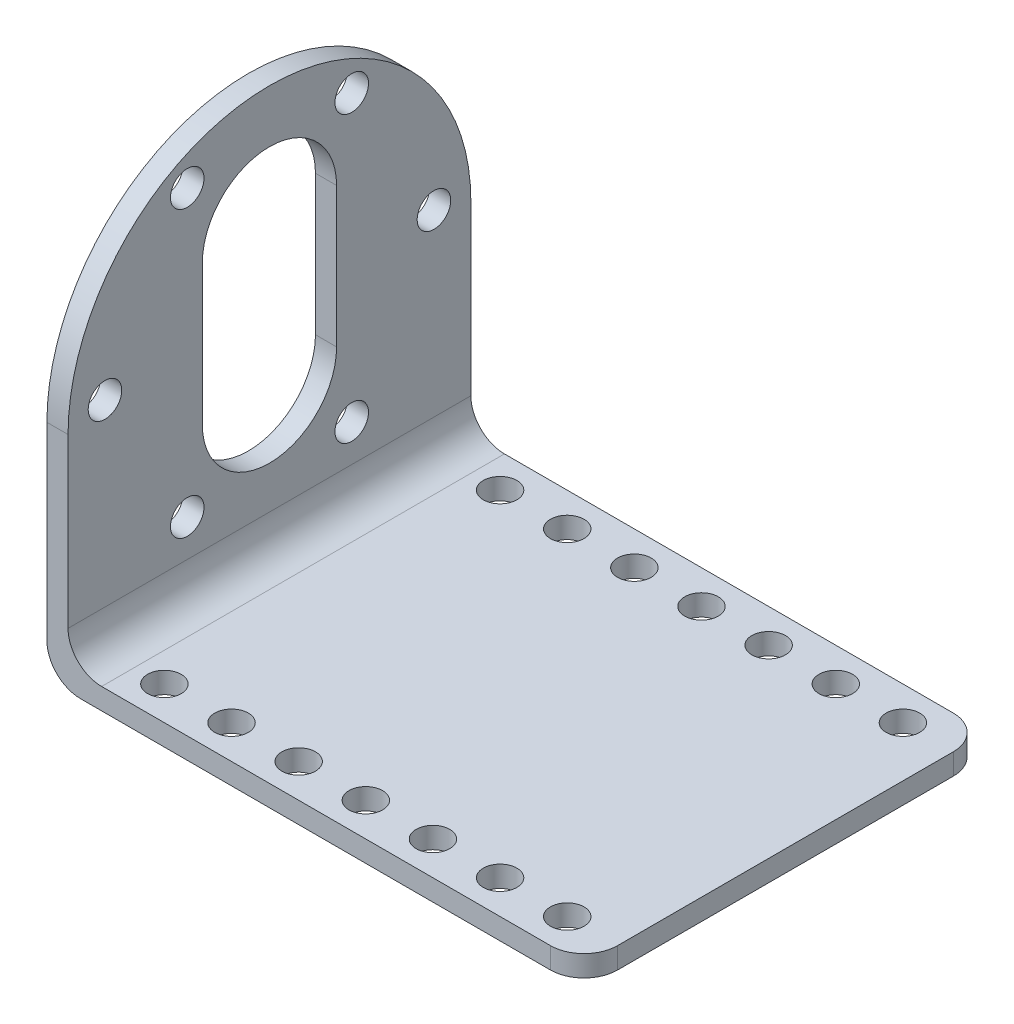
from build123d import *

# Parameters (mm, degrees)
SKETCH1_W           = 50.8
SKETCH1_H           = 38.1
BOSS_EXTRUDE1_DEPTH = 2.00000108
SKETCH2_W           = 2.00000108
SKETCH2_H           = 38.1
BOSS_EXTRUDE2_DEPTH = 38.1
SKETCH4_R           = 1.5875
CUT_EXTRUDE1_DEPTH  = 5.08
CUT_EXTRUDE3_DEPTH  = 2.54
FILLET1_R           = 3.175
SKETCH6_R           = 1.5875
CUT_EXTRUDE4_DEPTH  = 2.54


with BuildPart() as part:
    # Sketch1 → Boss-Extrude1 (new body)
    with BuildSketch(Plane(origin=(0, 0, 0), x_dir=(1, 0, 0), z_dir=(0, 1, 0))):
        with Locations((-21.481677668, -11.673311185)):
            Rectangle(SKETCH1_W, SKETCH1_H)
    extrude(amount=BOSS_EXTRUDE1_DEPTH)

    # Sketch2 → Boss-Extrude2 (add)
    with BuildSketch(Plane(origin=(0, 2.00000108, 0), x_dir=(1, 0, 0), z_dir=(0, 1, 0))):
        with Locations((-45.881677128, -11.673311185)):
            Rectangle(SKETCH2_W, SKETCH2_H)
    extrude(amount=BOSS_EXTRUDE2_DEPTH)

    # Sketch4 → Cut-Extrude1 (cut)
    with BuildSketch(Plane(origin=(0, 2.00000108, 0), x_dir=(1, 0, 0), z_dir=(0, 1, 0))):
        with Locations(Location((-0.844177668, -27.548311185, 0), (0, 0, 270))):
            Circle(SKETCH4_R)
        with Locations(Location((-7.194177668, -27.548311185, 0), (0, 0, 270))):
            Circle(SKETCH4_R)
        with Locations(Location((-13.544177668, -27.548311185, 0), (0, 0, 270))):
            Circle(SKETCH4_R)
        with Locations(Location((-19.894177668, -27.548311185, 0), (0, 0, 270))):
            Circle(SKETCH4_R)
        with Locations(Location((-26.244177668, -27.548311185, 0), (0, 0, 270))):
            Circle(SKETCH4_R)
        with Locations(Location((-32.594177668, -27.548311185, 0), (0, 0, 270))):
            Circle(SKETCH4_R)
        with Locations(Location((-38.944177668, -27.548311185, 0), (0, 0, 270))):
            Circle(SKETCH4_R)
        with Locations(Location((-0.844177668, 4.201688815, 0), (0, 0, 270))):
            Circle(SKETCH4_R)
        with Locations(Location((-7.194177668, 4.201688815, 0), (0, 0, 270))):
            Circle(SKETCH4_R)
        with Locations(Location((-13.544177668, 4.201688815, 0), (0, 0, 270))):
            Circle(SKETCH4_R)
        with Locations(Location((-19.894177668, 4.201688815, 0), (0, 0, 270))):
            Circle(SKETCH4_R)
        with Locations(Location((-26.244177668, 4.201688815, 0), (0, 0, 270))):
            Circle(SKETCH4_R)
        with Locations(Location((-32.594177668, 4.201688815, 0), (0, 0, 270))):
            Circle(SKETCH4_R)
        with Locations(Location((-38.944177668, 4.201688815, 0), (0, 0, 270))):
            Circle(SKETCH4_R)
    extrude(amount=-CUT_EXTRUDE1_DEPTH, mode=Mode.SUBTRACT)

    # Sketch5 → Cut-Extrude3 (cut)
    with BuildSketch(Plane(origin=(-46.881677668, 0, 30.723311185), x_dir=(0, 0, -1), z_dir=(1, 0, 0))):
        with BuildLine():
            ThreePointArc((19.05, 40.10000108), (32.520384182, 34.520385262), (38.1, 21.05000108))
            Line((38.1, 21.05000108), (38.1, 40.10000108))
            Line((38.1, 40.10000108), (19.05, 40.10000108))
        make_face()
        with BuildLine():
            Line((0, 40.10000108), (0, 21.05000108))
            ThreePointArc((0, 21.05000108), (5.579615818, 34.520385262), (19.05, 40.10000108))
            Line((19.05, 40.10000108), (0, 40.10000108))
        make_face()
    extrude(amount=CUT_EXTRUDE3_DEPTH, mode=Mode.SUBTRACT)

    # Fillet1
    fillet1_edges = [part.edges().sort_by_distance(p)[0] for p in [
        (-46.881677668, 0, 11.673311185),
        (-44.881676588, 2.00000108, 11.673311185),
        (3.918322332, 1.00000054, -7.376688815),
        (3.918322332, 1.00000054, 30.723311185),
    ]]
    fillet(fillet1_edges, radius=FILLET1_R)

    # Sketch6 → Cut-Extrude4 (cut)
    with BuildSketch(Plane(origin=(-46.881677668, 0, 30.723311185), x_dir=(0, 0, -1), z_dir=(1, 0, 0))):
        with Locations(Location((26.82875, 35.610695759, 0), (0, 0, 180))):
            Circle(SKETCH6_R)
        with Locations(Location((11.27125, 35.610695759, 0), (0, 0, 180))):
            Circle(SKETCH6_R)
        with Locations(Location((3.4925, 22.13750554, 0), (0, 0, 180))):
            Circle(SKETCH6_R)
        with BuildLine():
            Line((12.7, 21.05000108), (12.7, 15.525))
            ThreePointArc((12.7, 15.525), (19.05, 9.175), (25.4, 15.525))
            Line((25.4, 15.525), (25.4, 21.05000108))
            Line((25.4, 21.05000108), (25.4, 28.75001108))
            ThreePointArc((25.4, 28.75001108), (19.05, 35.10001108), (12.7, 28.75001108))
            Line((12.7, 28.75001108), (12.7, 21.05000108))
        make_face()
        with Locations(Location((34.6075, 22.13750554, 0), (0, 0, 180))):
            Circle(SKETCH6_R)
        with Locations(Location((26.82875, 8.664315321, 0), (0, 0, 180))):
            Circle(SKETCH6_R)
        with Locations(Location((11.27125, 8.664315321, 0), (0, 0, 180))):
            Circle(SKETCH6_R)
    extrude(amount=CUT_EXTRUDE4_DEPTH, mode=Mode.SUBTRACT)


solid = part.part
